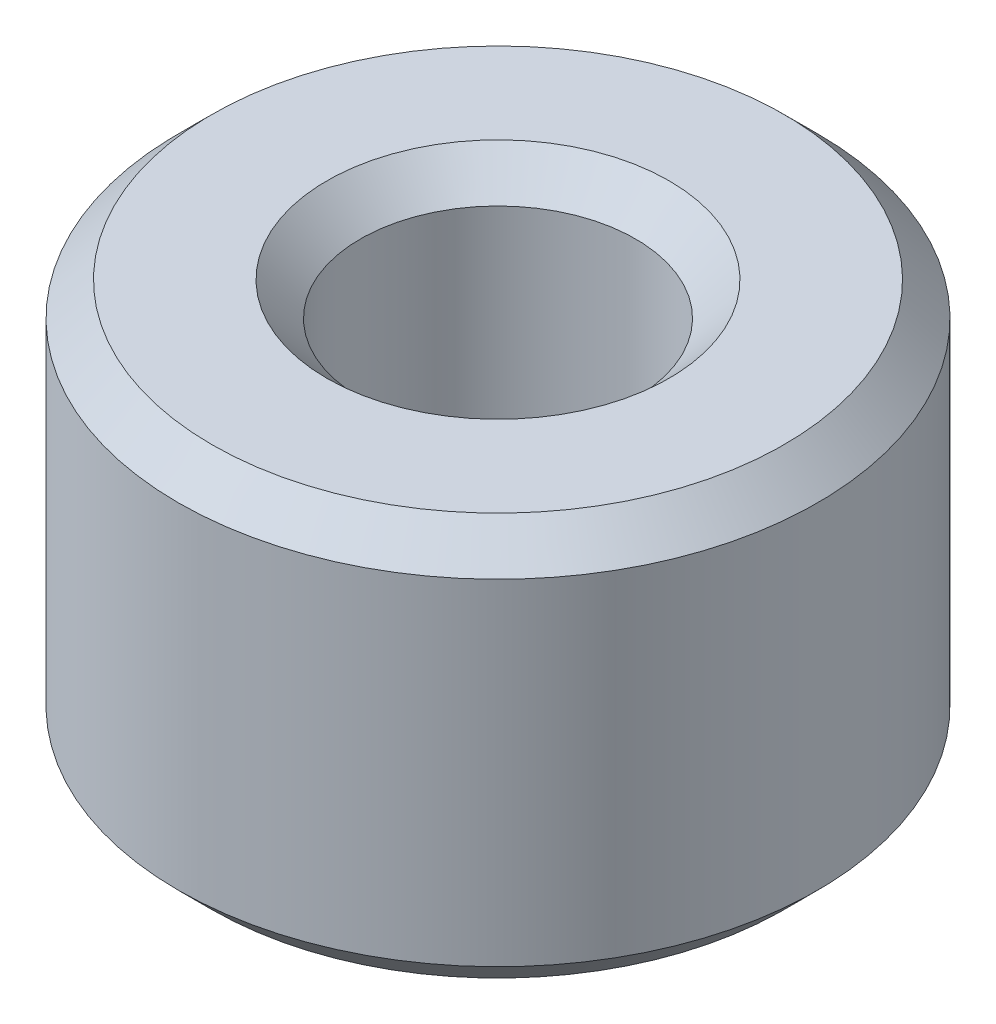
from build123d import *

# Parameters (mm, degrees)
SKETCH1_R           = 4.7625
SKETCH1_R_2         = 2.05
BOSS_EXTRUDE1_DEPTH = 6
CHAMFER1_SIZE       = 0.5


with BuildPart() as part:
    # Sketch1 → Boss-Extrude1 (new body)
    with BuildSketch(Plane(origin=(0, 0, 0), x_dir=(1, 0, 0), z_dir=(0, 1, 0))):
        with Locations(Location((0, 0, 0), (0, 0, 270))):
            Circle(SKETCH1_R)
        with Locations(Location((0, 0, 0), (0, 0, 270))):
            Circle(SKETCH1_R_2, mode=Mode.SUBTRACT)
    extrude(amount=BOSS_EXTRUDE1_DEPTH)

    # Chamfer1
    chamfer1_edges = [part.edges().sort_by_distance(p)[0] for p in [
        (0, 0, -4.7625),
        (0, 0, -2.05),
        (0, 6, -2.05),
        (0, 6, -4.7625),
    ]]
    chamfer(chamfer1_edges, length=CHAMFER1_SIZE)


solid = part.part
